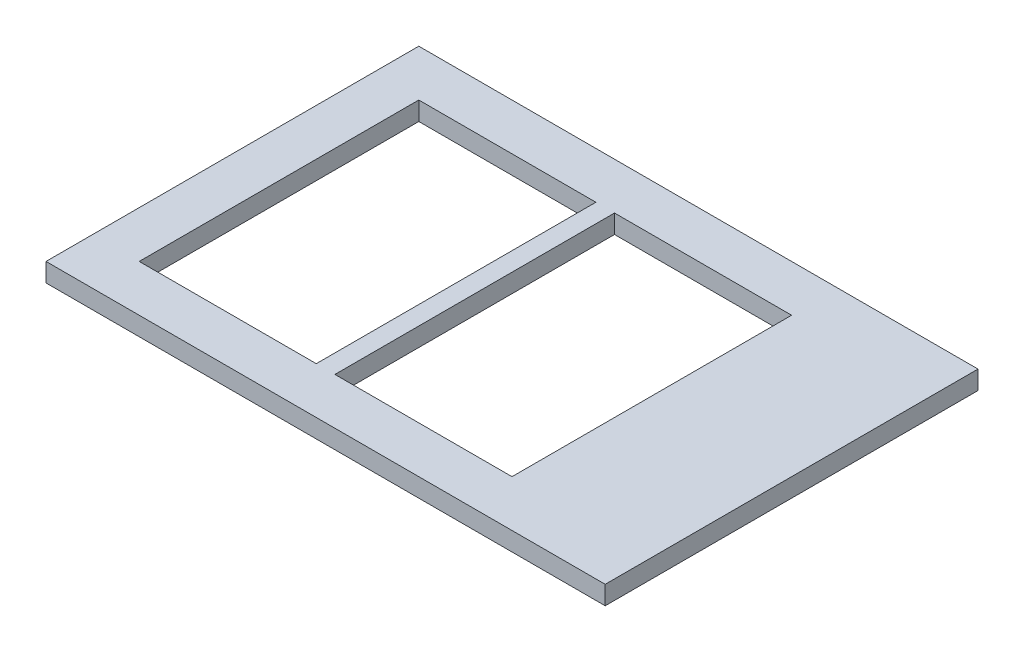
from build123d import *

# Parameters (mm, degrees)
SKETCH1_W           = 600
SKETCH1_H           = 400
BOSS_EXTRUDE2_DEPTH = 20
SKETCH1_10_W        = 190
SKETCH1_10_H        = 300
BOSS_EXTRUDE5_DEPTH = 20


with BuildPart() as part:
    # Sketch1 → Boss-Extrude2 (new body)
    with BuildSketch(Plane(origin=(0, 0, 0), x_dir=(1, 0, 0), z_dir=(0, 1, 0))):
        Rectangle(SKETCH1_W, SKETCH1_H)
        Polygon((-270, -170), (-270, 170), (170, 170), (170, 150), (170, -150), (170, -170), align=None, mode=Mode.SUBTRACT)
    extrude(amount=BOSS_EXTRUDE2_DEPTH)

    # Sketch1<10> → Boss-Extrude5 (add)
    with BuildSketch(Plane(origin=(0, 0, 0), x_dir=(1, 0, 0), z_dir=(0, 1, 0))):
        Polygon((170, 170), (-270, 170), (-270, -170), (170, -170), (170, -150), (170, 150), align=None)
        with Locations((-155, 0)):
            Rectangle(SKETCH1_10_W, SKETCH1_10_H, mode=Mode.SUBTRACT)
        with Locations((55, 0)):
            Rectangle(SKETCH1_10_W, SKETCH1_10_H, mode=Mode.SUBTRACT)
    extrude(amount=BOSS_EXTRUDE5_DEPTH)


solid = part.part
